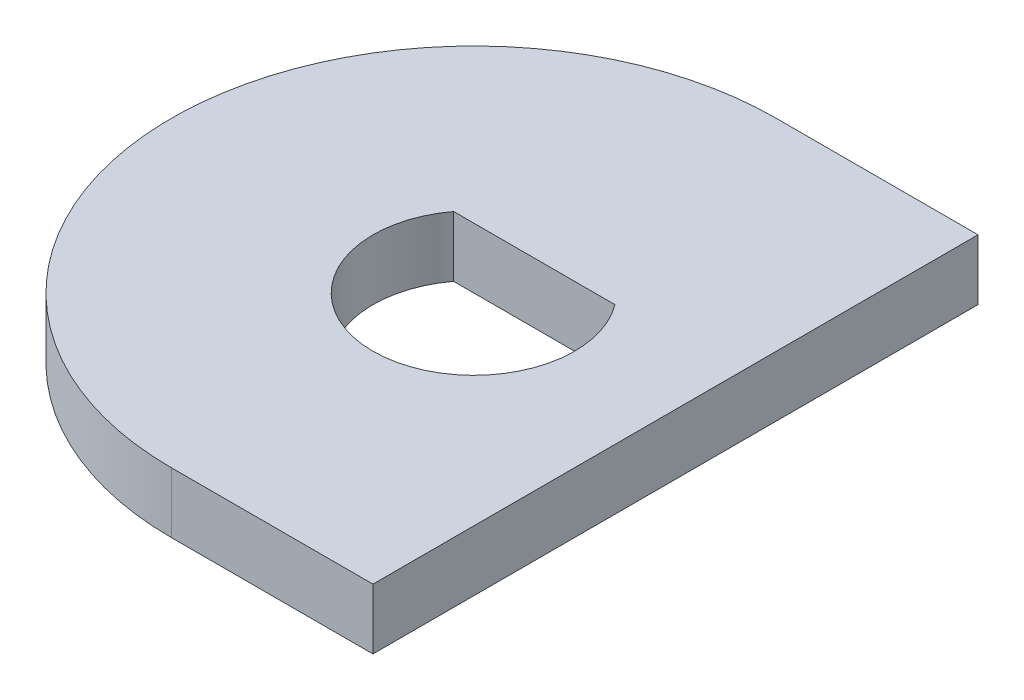
from build123d import *

# Parameters (mm, degrees)
BOSS_EXTRUDE3_DEPTH = 3


with BuildPart() as part:
    # Sketch4 → Boss-Extrude3 (new body)
    with BuildSketch(Plane(origin=(0, 0, 0), x_dir=(1, 0, 0), z_dir=(0, 1, 0))):
        with BuildLine():
            ThreePointArc((-3.047220201, 23.891690771), (-18.047220201, 8.891690771), (-3.047220201, -6.108309229))
            Line((-3.047220201, -6.108309229), (6.952779799, -6.108309229))
            Line((6.952779799, -6.108309229), (6.952779799, 23.891690771))
            Line((6.952779799, 23.891690771), (-3.047220201, 23.891690771))
        make_face()
        with BuildLine():
            Line((-7.047220201, 11.891690771), (0.952779799, 11.891690771))
            ThreePointArc((0.952779799, 11.891690771), (-3.047220201, 3.891690771), (-7.047220201, 11.891690771))
        make_face(mode=Mode.SUBTRACT)
    extrude(amount=BOSS_EXTRUDE3_DEPTH)


solid = part.part
